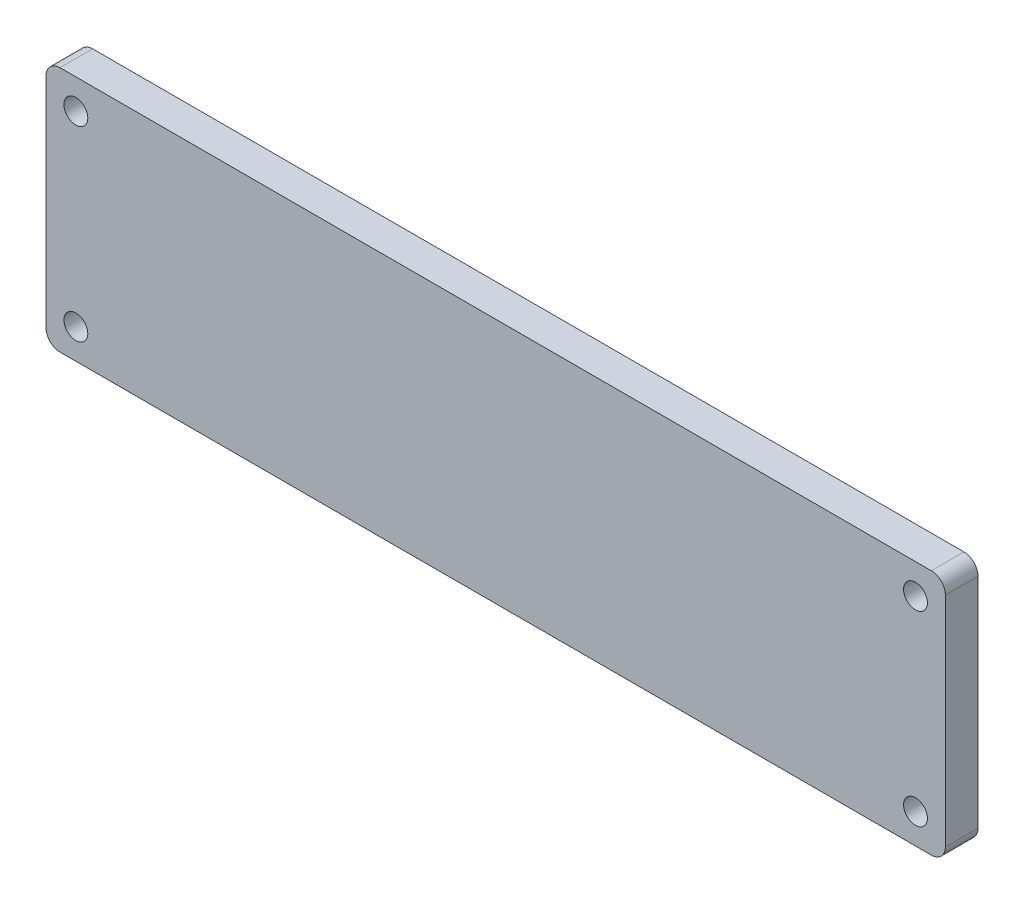
from build123d import *

# Parameters (mm, degrees)
SKETCH_1_R      = 1.28
EXTRUDE_1_DEPTH = 3.5


with BuildPart() as part:
    # 草图1 → 凸台-拉伸1 (new body)
    with BuildSketch(Plane.XY):
        with BuildLine():
            Line((-46.7, 13.2), (46.7, 13.2))
            ThreePointArc((46.7, 13.2), (47.760660172, 12.760660172), (48.2, 11.7))
            Line((48.2, 11.7), (48.2, -11.7))
            ThreePointArc((48.2, -11.7), (47.760660172, -12.760660172), (46.7, -13.2))
            Line((46.7, -13.2), (-46.7, -13.2))
            ThreePointArc((-46.7, -13.2), (-47.760660172, -12.760660172), (-48.2, -11.7))
            Line((-48.2, -11.7), (-48.2, 11.7))
            ThreePointArc((-48.2, 11.7), (-47.760660172, 12.760660172), (-46.7, 13.2))
        make_face()
        with Locations((-45, 10)):
            Circle(SKETCH_1_R, mode=Mode.SUBTRACT)
        with Locations((45, 10)):
            Circle(SKETCH_1_R, mode=Mode.SUBTRACT)
        with Locations((45, -10)):
            Circle(SKETCH_1_R, mode=Mode.SUBTRACT)
        with Locations((-45, -10)):
            Circle(SKETCH_1_R, mode=Mode.SUBTRACT)
    extrude(amount=EXTRUDE_1_DEPTH)


solid = part.part
